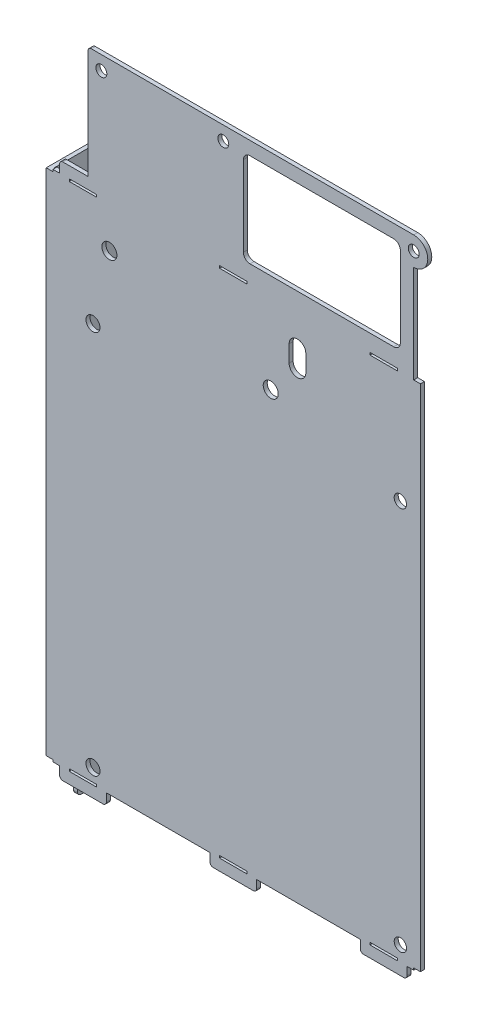
from build123d import *

# Parameters (mm, degrees)
SKETCH2_W           = 112.00010125
SKETCH2_H           = 190.5995575
SKETCH2_R           = 2.1
SKETCH2_R_2         = 1.85
BOSS_EXTRUDE1_DEPTH = 1.2
SKETCH5_W           = 2
SKETCH5_H           = 37.6
SKETCH5_H_2         = 0.6
CUT_EXTRUDE2_DEPTH  = 247.246128205
CUT_EXTRUDE1_DEPTH  = 247.246128205
SKETCH9_W           = 14
SKETCH9_H           = 3.4
SKETCH9_W_2         = 8.5
BOSS_EXTRUDE5_DEPTH = 1.2
FILLET1_R           = 1
CUT_EXTRUDE4_REACH  = 248.246
SKETCH10_W          = 8.2
SKETCH10_H          = 0.7
SKETCH11_R          = 2.25
CUT_EXTRUDE5_DEPTH  = 247.246128205
BOSS_EXTRUDE6_DEPTH = 1.2
SKETCH13_R          = 1.635773904
CUT_EXTRUDE6_DEPTH  = 248.202612706
SKETCH14_W          = 1.2
SKETCH14_H          = 152.3995575
BOSS_EXTRUDE7_DEPTH = 32
BOSS_EXTRUDE8_DEPTH = 1.2
BOSS_EXTRUDE9_DEPTH = 1.2
CUT_EXTRUDE7_REACH  = 254.685
FILLET2_R           = 1


with BuildPart() as part:
    # Sketch2 → Boss-Extrude1 (new body)
    with BuildSketch(Plane.XY):
        with Locations((50.167238625, 126.88082875)):
            Rectangle(SKETCH2_W, SKETCH2_H)
        with Locations((8.16763175, 151.180160625)):
            Circle(SKETCH2_R, mode=Mode.SUBTRACT)
        with Locations((100.1668405, 151.180160625)):
            Circle(SKETCH2_R_2, mode=Mode.SUBTRACT)
        with Locations((100.1668405, 36.181495)):
            Circle(SKETCH2_R_2, mode=Mode.SUBTRACT)
        with Locations((8.16763175, 36.181495)):
            Circle(SKETCH2_R, mode=Mode.SUBTRACT)
    extrude(amount=BOSS_EXTRUDE1_DEPTH)

    # Sketch5 → Cut-Extrude2 (cut, through all)
    with BuildSketch(Plane.XY.offset(1.2)):
        Polygon((-3.832812, 185.1806075), (6.667188, 185.1806075), (6.667188, 222.1806075), (-5.832812, 222.1806075), (-5.832812, 185.1806075), (-5.832812, 184.5806075), (-3.832812, 184.5806075), align=None)
        with Locations((105.16728925, 203.3806075)):
            Rectangle(SKETCH5_W, SKETCH5_H)
        with Locations((-4.832812, 31.88105)):
            Rectangle(SKETCH5_W, SKETCH5_H_2)
        with Locations((105.16728925, 31.88105)):
            Rectangle(SKETCH5_W, SKETCH5_H_2)
    extrude(amount=-CUT_EXTRUDE2_DEPTH, mode=Mode.SUBTRACT)

    # Sketch4 → Cut-Extrude1 (cut, through all)
    with BuildSketch(Plane.XY.offset(1.2)):
        with BuildLine():
            Line((55.16728925, 218.1806075), (98.16728925, 218.1806075))
            ThreePointArc((98.16728925, 218.1806075), (99.581502812, 217.594821062), (100.16728925, 216.1806075))
            Line((100.16728925, 216.1806075), (100.16728925, 192.1806075))
            ThreePointArc((100.16728925, 192.1806075), (99.581502812, 190.766393938), (98.16728925, 190.1806075))
            Line((98.16728925, 190.1806075), (55.16728925, 190.1806075))
            ThreePointArc((55.16728925, 190.1806075), (53.753075688, 190.766393938), (53.16728925, 192.1806075))
            Line((53.16728925, 192.1806075), (53.16728925, 216.1806075))
            ThreePointArc((53.16728925, 216.1806075), (53.753075688, 217.594821062), (55.16728925, 218.1806075))
        make_face()
    extrude(amount=-CUT_EXTRUDE1_DEPTH, mode=Mode.SUBTRACT)

    # Sketch9 → Boss-Extrude5 (add)
    with BuildSketch(Plane.XY.offset(1.2)):
        with Locations((5.167188, 29.88105)):
            Rectangle(SKETCH9_W, SKETCH9_H)
        with Locations((95.16728925, 29.88105)):
            Rectangle(SKETCH9_W, SKETCH9_H)
        with Locations((50.167238625, 29.88105)):
            Rectangle(SKETCH9_W, SKETCH9_H)
        with Locations((2.417188, 186.8806075)):
            Rectangle(SKETCH9_W_2, SKETCH9_H)
    extrude(amount=-BOSS_EXTRUDE5_DEPTH)

    # Fillet1
    fillet1_edges = [part.edges().sort_by_distance(p)[0] for p in [
        (102.16728925, 28.18105, 0.6),
        (88.16728925, 28.18105, 0.6),
        (57.167238625, 28.18105, 0.6),
        (43.167238625, 28.18105, 0.6),
        (12.167188, 28.18105, 0.6),
        (-1.832812, 28.18105, 0.6),
        (-1.832812, 188.5806075, 0.6),
    ]]
    fillet(fillet1_edges, radius=FILLET1_R)

    # Sketch10 → Cut-Extrude4 (cut, up to next)
    with BuildSketch(Plane.XY.offset(1.2), mode=Mode.PRIVATE) as cut_extrude4_sk1:
        with Locations((95.16728925, 31.93105)):
            Rectangle(SKETCH10_W, SKETCH10_H)
    cut_extrude4_tool1 = extrude(cut_extrude4_sk1.sketch, amount=-CUT_EXTRUDE4_REACH, mode=Mode.PRIVATE) & part.part
    # Sketch10 → Cut-Extrude4 (cut, up to next)
    with BuildSketch(Plane.XY.offset(1.2), mode=Mode.PRIVATE) as cut_extrude4_sk2:
        with Locations((50.167238625, 31.93105)):
            Rectangle(SKETCH10_W, SKETCH10_H)
    cut_extrude4_tool2 = extrude(cut_extrude4_sk2.sketch, amount=-CUT_EXTRUDE4_REACH, mode=Mode.PRIVATE) & part.part
    # Sketch10 → Cut-Extrude4 (cut, up to next)
    with BuildSketch(Plane.XY.offset(1.2), mode=Mode.PRIVATE) as cut_extrude4_sk3:
        with Locations((5.167188, 31.93105)):
            Rectangle(SKETCH10_W, SKETCH10_H)
    cut_extrude4_tool3 = extrude(cut_extrude4_sk3.sketch, amount=-CUT_EXTRUDE4_REACH, mode=Mode.PRIVATE) & part.part
    # Sketch10 → Cut-Extrude4 (cut, up to next)
    with BuildSketch(Plane.XY.offset(1.2), mode=Mode.PRIVATE) as cut_extrude4_sk4:
        with Locations((50.167238625, 184.8306075)):
            Rectangle(SKETCH10_W, SKETCH10_H)
    cut_extrude4_tool4 = extrude(cut_extrude4_sk4.sketch, amount=-CUT_EXTRUDE4_REACH, mode=Mode.PRIVATE) & part.part
    # Sketch10 → Cut-Extrude4 (cut, up to next)
    with BuildSketch(Plane.XY.offset(1.2), mode=Mode.PRIVATE) as cut_extrude4_sk5:
        with Locations((95.16728925, 184.8306075)):
            Rectangle(SKETCH10_W, SKETCH10_H)
    cut_extrude4_tool5 = extrude(cut_extrude4_sk5.sketch, amount=-CUT_EXTRUDE4_REACH, mode=Mode.PRIVATE) & part.part
    # Sketch10 → Cut-Extrude4 (cut, up to next)
    with BuildSketch(Plane.XY.offset(1.2), mode=Mode.PRIVATE) as cut_extrude4_sk6:
        with Locations((5.167188, 184.8306075)):
            Rectangle(SKETCH10_W, SKETCH10_H)
    cut_extrude4_tool6 = extrude(cut_extrude4_sk6.sketch, amount=-CUT_EXTRUDE4_REACH, mode=Mode.PRIVATE) & part.part
    add(cut_extrude4_tool1.solids().sort_by_distance((95.167289, 31.93105, 1.2))[0], mode=Mode.SUBTRACT)
    add(cut_extrude4_tool2.solids().sort_by_distance((50.167239, 31.93105, 1.2))[0], mode=Mode.SUBTRACT)
    add(cut_extrude4_tool3.solids().sort_by_distance((5.167188, 31.93105, 1.2))[0], mode=Mode.SUBTRACT)
    add(cut_extrude4_tool4.solids().sort_by_distance((50.167239, 184.830607, 1.2))[0], mode=Mode.SUBTRACT)
    add(cut_extrude4_tool5.solids().sort_by_distance((95.167289, 184.830607, 1.2))[0], mode=Mode.SUBTRACT)
    add(cut_extrude4_tool6.solids().sort_by_distance((5.167188, 184.830607, 1.2))[0], mode=Mode.SUBTRACT)

    # Sketch11 → Cut-Extrude5 (cut, through all)
    with BuildSketch(Plane.XY.offset(1.2)):
        with Locations((61.367697375, 160.67994375)):
            Circle(SKETCH11_R)
        with Locations((13.067697375, 172.47994375)):
            Circle(SKETCH11_R)
        with BuildLine():
            Line((71.867697375, 175.27994375), (71.867697375, 170.27994375))
            ThreePointArc((71.867697375, 170.27994375), (69.367697375, 167.77994375), (66.867697375, 170.27994375))
            Line((66.867697375, 170.27994375), (66.867697375, 175.27994375))
            ThreePointArc((66.867697375, 175.27994375), (69.367697375, 177.77994375), (71.867697375, 175.27994375))
        make_face()
    extrude(amount=-CUT_EXTRUDE5_DEPTH, mode=Mode.SUBTRACT)

    # Sketch12 → Boss-Extrude6 (add)
    with BuildSketch(Plane.XY.offset(1.2)):
        with BuildLine():
            Line((104.16728925, 222.1806075), (104.16728925, 213.7806075))
            ThreePointArc((104.16728925, 213.7806075), (108.36728925, 217.9806075), (104.16728925, 222.1806075))
        make_face()
    extrude(amount=-BOSS_EXTRUDE6_DEPTH)

    # Sketch13 → Cut-Extrude6 (cut, through all)
    with BuildSketch(Plane.XY.offset(1.2)):
        with Locations((104.16728925, 217.9806075)):
            Circle(SKETCH13_R)
        with Locations((47.16728925, 217.9806075)):
            Circle(SKETCH13_R)
        with Locations((10.667188, 217.9806075)):
            Circle(SKETCH13_R)
    extrude(amount=-CUT_EXTRUDE6_DEPTH, mode=Mode.SUBTRACT)

    # Sketch14 → Boss-Extrude7 (add)
    with BuildSketch(Plane(origin=(0, 0, 0), x_dir=(-1, 0, 0), z_dir=(0, 0, -1))):
        with Locations((5.232812, 108.38082875)):
            Rectangle(SKETCH14_W, SKETCH14_H)
    extrude(amount=BOSS_EXTRUDE7_DEPTH)

    # Sketch16 → Boss-Extrude8 (add)
    with BuildSketch(Plane.ZY.offset(5.832812)):
        with BuildLine():
            Line((-32, 32.18105), (-4, 32.18105))
            ThreePointArc((-4, 32.18105), (-6.121320344, 31.302370344), (-7, 29.18105))
            Line((-7, 29.18105), (-7, 18.18105))
            Line((-7, 18.18105), (-32, 18.18105))
            Line((-32, 18.18105), (-32, 32.18105))
        make_face()
    extrude(amount=-BOSS_EXTRUDE8_DEPTH)

    # Sketch17 → Boss-Extrude9 (add)
    with BuildSketch(Plane.ZY.offset(5.832812)):
        with BuildLine():
            Line((-32, 184.5806075), (-38, 184.5806075))
            Line((-38, 184.5806075), (-38, 168.5806075))
            Line((-38, 168.5806075), (-35, 168.5806075))
            ThreePointArc((-35, 168.5806075), (-32.878679656, 167.701927844), (-32, 165.5806075))
            Line((-32, 165.5806075), (-32, 184.5806075))
        make_face()
    extrude(amount=-BOSS_EXTRUDE9_DEPTH)

    # Sketch15 → Cut-Extrude7 (cut, up to next)
    with BuildSketch(Plane.ZY.offset(5.832812), mode=Mode.PRIVATE) as cut_extrude7_sk1:
        with BuildLine():
            Line((-46.8, 177.7806075), (-34.8, 177.7806075))
            ThreePointArc((-34.8, 177.7806075), (-33.2, 176.1806075), (-34.8, 174.5806075))
            Line((-34.8, 174.5806075), (-46.8, 174.5806075))
            ThreePointArc((-46.8, 174.5806075), (-48.4, 176.1806075), (-46.8, 177.7806075))
        make_face()
    cut_extrude7_tool1 = extrude(cut_extrude7_sk1.sketch, amount=-CUT_EXTRUDE7_REACH, mode=Mode.PRIVATE) & part.part
    # Sketch15 → Cut-Extrude7 (cut, up to next)
    with BuildSketch(Plane.ZY.offset(5.832812), mode=Mode.PRIVATE) as cut_extrude7_sk2:
        with BuildLine():
            Line((-26.1, 21.18105), (-26.1, 18.18105))
            Line((-26.1, 18.18105), (-22.9, 18.18105))
            Line((-22.9, 18.18105), (-22.9, 21.18105))
            ThreePointArc((-22.9, 21.18105), (-24.5, 22.78105), (-26.1, 21.18105))
        make_face()
    cut_extrude7_tool2 = extrude(cut_extrude7_sk2.sketch, amount=-CUT_EXTRUDE7_REACH, mode=Mode.PRIVATE) & part.part
    add(cut_extrude7_tool1.solids().sort_by_distance((-5.832812, 176.180608, -40.8))[0], mode=Mode.SUBTRACT)
    add(cut_extrude7_tool2.solids().sort_by_distance((-5.832812, 20.324349, -24.5))[0], mode=Mode.SUBTRACT)

    # Fillet2
    fillet2_edges = [part.edges().sort_by_distance(p)[0] for p in [
        (6.667188, 222.1806075, 0.6),
        (-5.232812, 18.18105, -32),
        (-5.232812, 18.18105, -7),
        (-5.232812, 168.5806075, -38),
        (-5.232812, 184.5806075, -38),
    ]]
    fillet(fillet2_edges, radius=FILLET2_R)


solid = part.part
